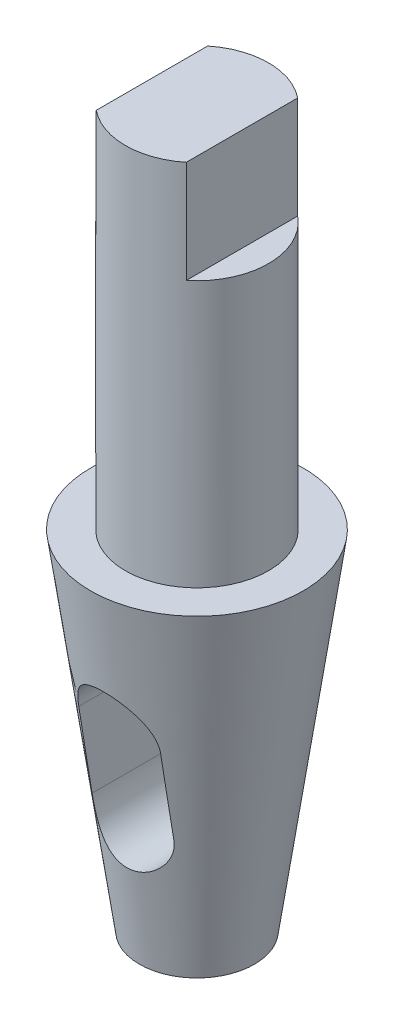
from build123d import *

# Parameters (mm, degrees)
CUT_EXTRUDE_1_DEPTH = 25
CUT_EXTRUDE_START   = -25
CUT_EXTRUDE_2_DEPTH = 25


with BuildPart() as part:
    # Эскиз1 → Повернуть1 (revolve)
    with BuildSketch(Plane.XY, mode=Mode.PRIVATE) as revolve_1_sk:
        Polygon((0, 0), (17.5, 0), (17.5, -90), (26, -90), (14.05402905, -175), (0, -175), align=None)
    revolve(revolve_1_sk.sketch.rotate(Axis((0, 0, 0), (0, -1, 0)), 90), axis=Axis((0, 0, 0), (0, -1, 0)))

    # Эскиз2 → Вырез-Вытянуть1 (cut, symmetric)
    with BuildSketch(Plane.XY):
        with BuildLine():
            Line((10, -123), (10, -143))
            ThreePointArc((10, -143), (0, -153), (-10, -143))
            Line((-10, -143), (-10, -123))
            ThreePointArc((-10, -123), (0, -113), (10, -123))
        make_face()
    extrude(amount=CUT_EXTRUDE_1_DEPTH, both=True, mode=Mode.SUBTRACT)

    # Эскиз3 → Вырез-Вытянуть2 (cut)
    with BuildSketch(Plane(origin=(0, 0, 0), x_dir=(1, 0, 0), z_dir=(0, 1, 0)).offset(CUT_EXTRUDE_START)):
        with BuildLine():
            Line((-11, -13.610657589), (-11, 13.610657589))
            ThreePointArc((-11, 13.610657589), (-17.5, 0), (-11, -13.610657589))
        make_face()
        with BuildLine():
            ThreePointArc((17.5, 0), (15.791611697, 7.541551564), (11, 13.610657589))
            Line((11, 13.610657589), (11, -13.610657589))
            ThreePointArc((11, -13.610657589), (15.791611697, -7.541551564), (17.5, 0))
        make_face()
    extrude(amount=CUT_EXTRUDE_2_DEPTH, mode=Mode.SUBTRACT)


solid = part.part
